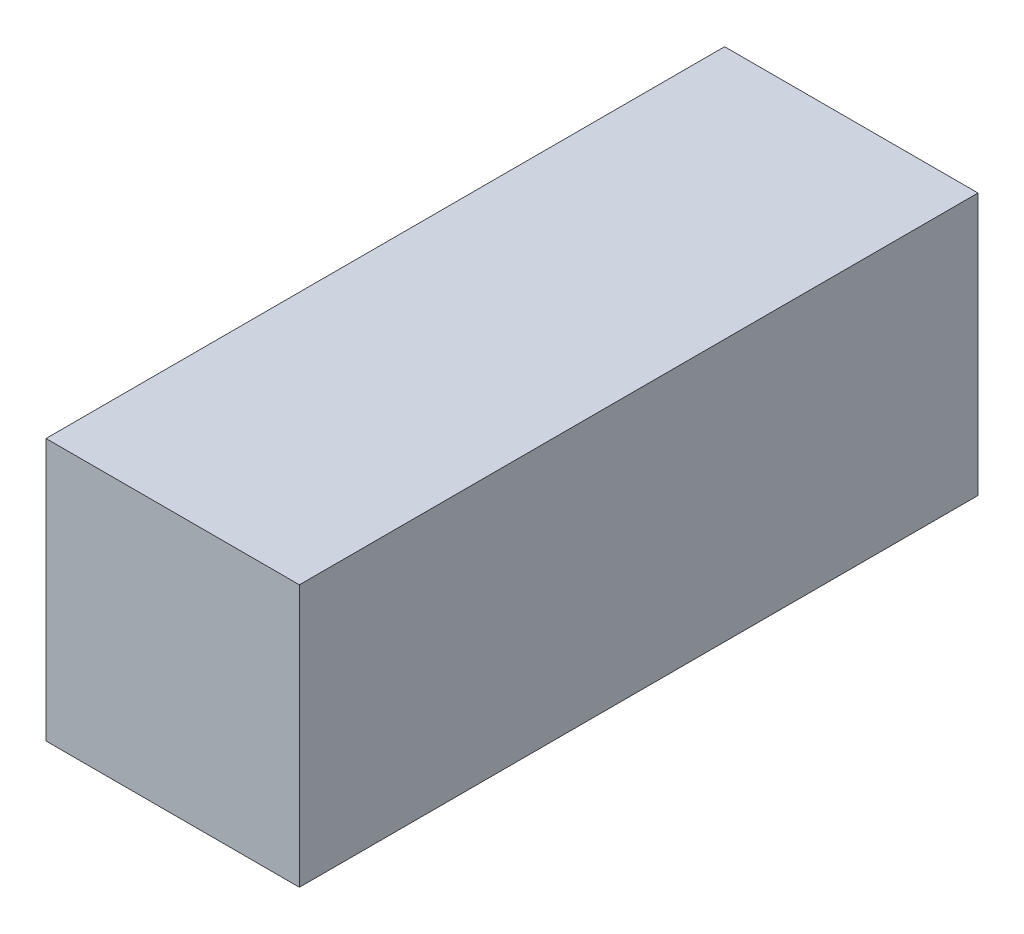
from build123d import *

# Parameters (mm, degrees)
SKETCH2_W                = 59
SKETCH2_H                = 158
F_11000MAH_BATTERY_DEPTH = 61


with BuildPart() as part:
    # Sketch2 → 11000mah battery (new body)
    with BuildSketch(Plane(origin=(0, 0, 0), x_dir=(1, 0, 0), z_dir=(0, 1, 0))):
        Rectangle(SKETCH2_W, SKETCH2_H)
    extrude(amount=F_11000MAH_BATTERY_DEPTH)


solid = part.part
